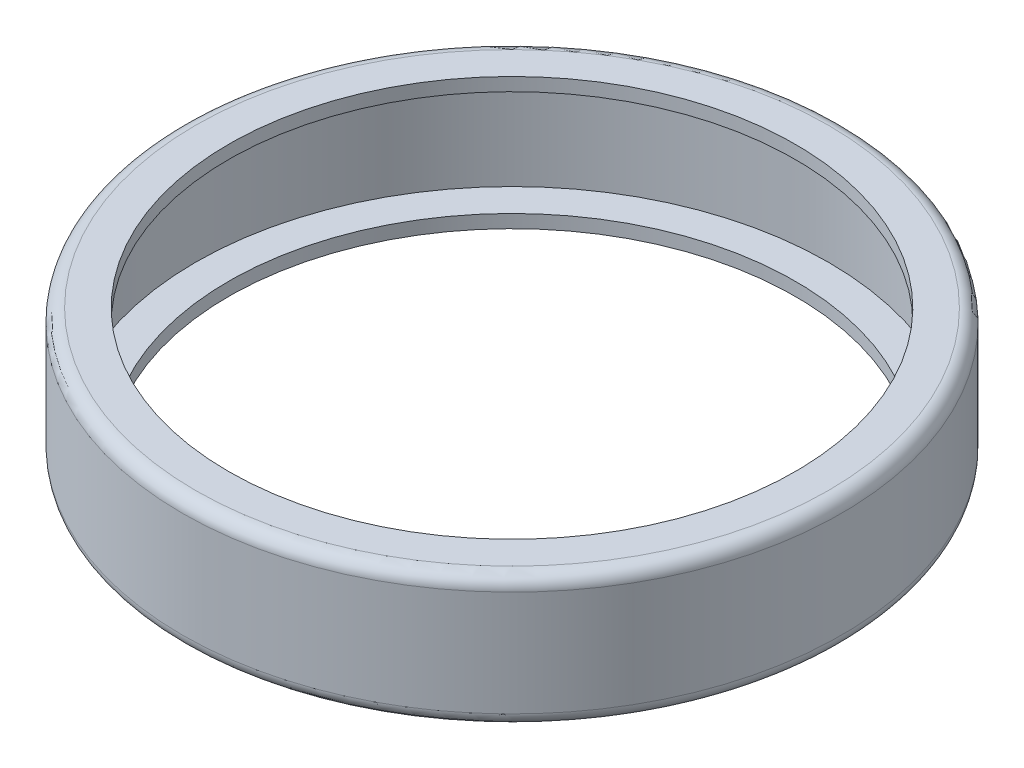
from build123d import *

# Parameters (mm, degrees)
FILLET1_R = 2.54


with BuildPart() as part:
    # Sketch1 → Revolve1 (revolve)
    with BuildSketch(Plane.XY, mode=Mode.PRIVATE) as revolve1_sk:
        Polygon((-54.61, 25.4), (-63.5, 25.4), (-63.5, 0), (-54.61, 0), (-54.61, 2.54), (-60.96, 2.54), (-60.96, 22.86), (-54.61, 22.86), align=None)
    revolve(revolve1_sk.sketch.rotate(Axis((0, 17.70925012, 0), (0, -1, 0)), 270), axis=Axis((0, 17.70925012, 0), (0, -1, 0)))

    # Fillet1
    fillet1_edges = [part.edges().sort_by_distance(p)[0] for p in [
        (0, 0, -63.5),
        (0, 25.4, -63.5),
    ]]
    fillet(fillet1_edges, radius=FILLET1_R)


solid = part.part
